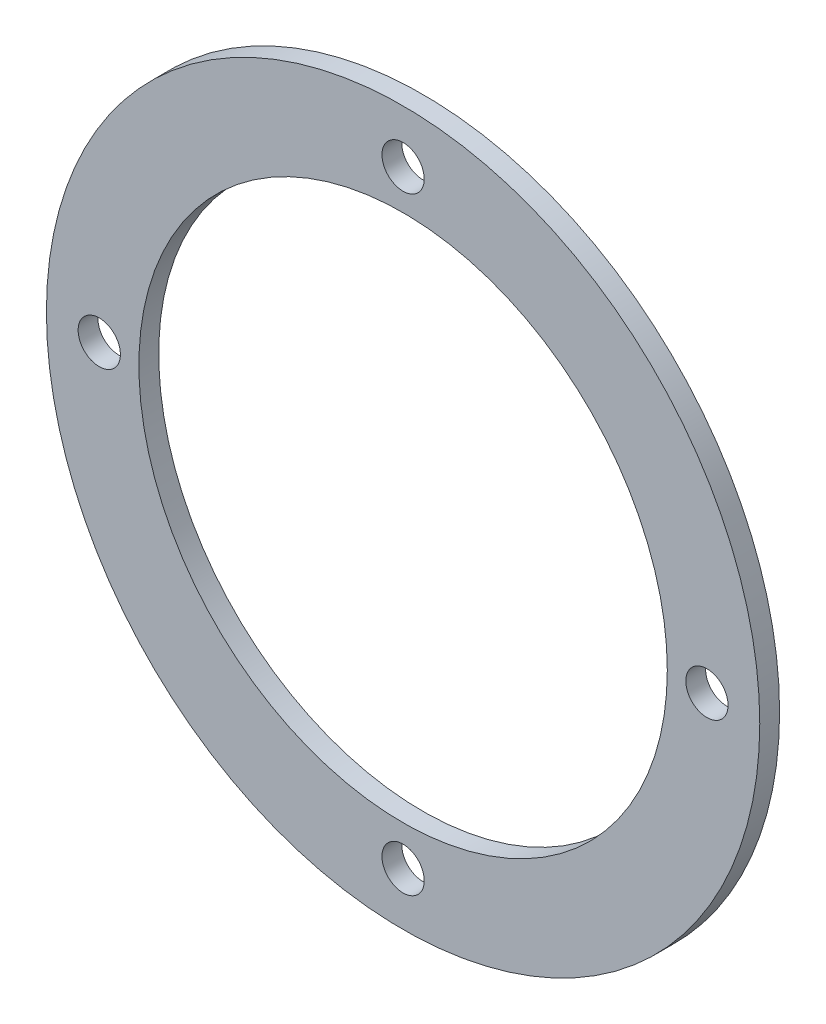
from build123d import *

# Parameters (mm, degrees)
SKETCH_1_R      = 27
SKETCH_1_R_2    = 20
SKETCH_1_R_3    = 1.6
EXTRUDE_1_DEPTH = 1.5


with BuildPart() as part:
    # 草图1 → 凸台-拉伸1 (new body)
    with BuildSketch(Plane.XY):
        Circle(SKETCH_1_R)
        Circle(SKETCH_1_R_2, mode=Mode.SUBTRACT)
        with Locations((0, 23)):
            Circle(SKETCH_1_R_3, mode=Mode.SUBTRACT)
        with Locations((23, 0)):
            Circle(SKETCH_1_R_3, mode=Mode.SUBTRACT)
        with Locations((0, -23)):
            Circle(SKETCH_1_R_3, mode=Mode.SUBTRACT)
        with Locations((-23, 0)):
            Circle(SKETCH_1_R_3, mode=Mode.SUBTRACT)
    extrude(amount=EXTRUDE_1_DEPTH)


solid = part.part
